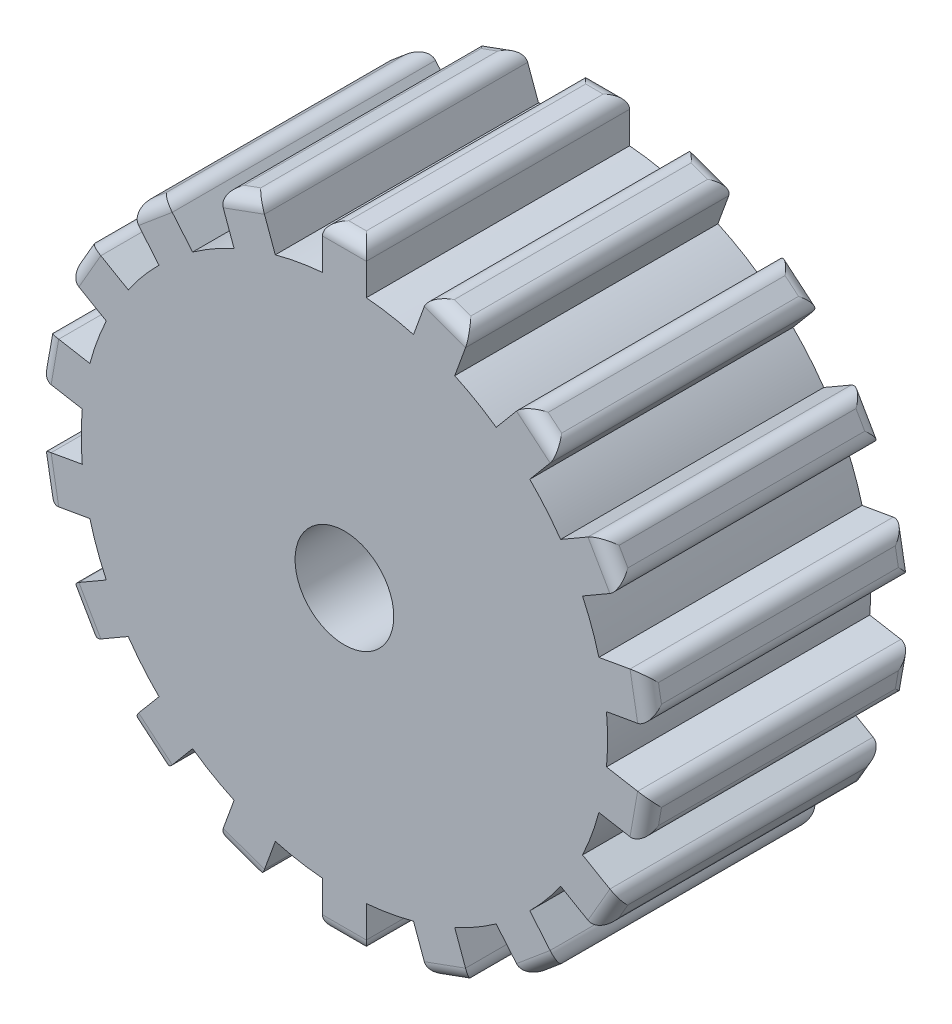
from build123d import *

# Parameters (mm, degrees)
SKETCH2_R                = 60
BOSS_EXTRUDE1_DEPTH      = 60
SKETCH3_W                = 10
SKETCH3_H                = 10.47851478
BOSS_EXTRUDE2_DEPTH      = 60
FILLET2_R                = 3
CIRPATTERN1_COUNT        = 18
FILLET2_OF_CIRPATTERN1_R = 3
SKETCH4_R                = 10
CUT_EXTRUDE1_DEPTH       = 60
SKETCH5_R                = 11.25
CUT_EXTRUDE2_DEPTH       = 60
SCALE1_SCALE             = 0.2


with BuildPart() as part:
    # Sketch2 → Boss-Extrude1 (new body)
    with BuildSketch(Plane.XY):
        Circle(SKETCH2_R)
    extrude(amount=BOSS_EXTRUDE1_DEPTH)

    # Sketch3 → Boss-Extrude2 (add)
    with BuildSketch(Plane.XY.offset(60)):
        with Locations((0, 64.76074261)):
            Rectangle(SKETCH3_W, SKETCH3_H)
    boss_extrude2 = extrude(amount=-BOSS_EXTRUDE2_DEPTH)

    # Fillet2
    fillet2_edges = [part.edges().sort_by_distance(p)[0] for p in [
        (5, 70, 30),
        (0, 70, 0),
        (-5, 70, 30),
        (0, 70, 60),
    ]]
    fillet(fillet2_edges, radius=FILLET2_R)

    # CirPattern1: Boss-Extrude2 ×18 about axis
    cirpattern1_axis = Axis((0, 0, 0), (0, 0, 1))
    for i in range(1, CIRPATTERN1_COUNT):
        add(boss_extrude2.rotate(cirpattern1_axis, i * 360 / CIRPATTERN1_COUNT))

    # Fillet2 of CirPattern1
    fillet2_of_cirpattern1_edges = [part.edges().sort_by_distance(p)[0] for p in [
        (-19.242946929, 67.488584172, 30),
        (-23.941410033, 65.778483455, 0),
        (-28.639873137, 64.068382738, 30),
        (-23.941410033, 65.778483455, 60),
        (-41.164910462, 56.837049067, 30),
        (-44.995132678, 53.623111018, 0),
        (-48.825354894, 50.40917297, 30),
        (-44.995132678, 53.623111018, 60),
        (-58.121778265, 39.330127019, 30),
        (-60.621778265, 35, 0),
        (-63.121778265, 30.669872981, 30),
        (-60.621778265, 35, 60),
        (-68.068301823, 17.079411202, 30),
        (-68.936542711, 12.155372437, 0),
        (-69.804783599, 7.231333672, 30),
        (-68.936542711, 12.155372437, 60),
        (-69.804783599, -7.231333672, 30),
        (-68.936542711, -12.155372437, 0),
        (-68.068301823, -17.079411202, 30),
        (-68.936542711, -12.155372437, 60),
        (-63.121778265, -30.669872981, 30),
        (-60.621778265, -35, 0),
        (-58.121778265, -39.330127019, 30),
        (-60.621778265, -35, 60),
        (-48.825354894, -50.40917297, 30),
        (-44.995132678, -53.623111018, 0),
        (-41.164910462, -56.837049067, 30),
        (-44.995132678, -53.623111018, 60),
        (-28.639873137, -64.068382738, 30),
        (-23.941410033, -65.778483455, 0),
        (-19.242946929, -67.488584172, 30),
        (-23.941410033, -65.778483455, 60),
        (-5, -70, 30),
        (0, -70, 0),
        (5, -70, 30),
        (0, -70, 60),
        (19.242946929, -67.488584172, 30),
        (23.941410033, -65.778483455, 0),
        (28.639873137, -64.068382738, 30),
        (23.941410033, -65.778483455, 60),
        (41.164910462, -56.837049067, 30),
        (44.995132678, -53.623111018, 0),
        (48.825354894, -50.40917297, 30),
        (44.995132678, -53.623111018, 60),
        (58.121778265, -39.330127019, 30),
        (60.621778265, -35, 0),
        (63.121778265, -30.669872981, 30),
        (60.621778265, -35, 60),
        (68.068301823, -17.079411202, 30),
        (68.936542711, -12.155372437, 0),
        (69.804783599, -7.231333672, 30),
        (68.936542711, -12.155372437, 60),
        (69.804783599, 7.231333672, 30),
        (68.936542711, 12.155372437, 0),
        (68.068301823, 17.079411202, 30),
        (68.936542711, 12.155372437, 60),
        (63.121778265, 30.669872981, 30),
        (60.621778265, 35, 0),
        (58.121778265, 39.330127019, 30),
        (60.621778265, 35, 60),
        (48.825354894, 50.40917297, 30),
        (44.995132678, 53.623111018, 0),
        (41.164910462, 56.837049067, 30),
        (44.995132678, 53.623111018, 60),
        (28.639873137, 64.068382738, 30),
        (23.941410033, 65.778483455, 0),
        (19.242946929, 67.488584172, 30),
        (23.941410033, 65.778483455, 60),
    ]]
    fillet(fillet2_of_cirpattern1_edges, radius=FILLET2_OF_CIRPATTERN1_R)

    # Sketch4 → Cut-Extrude1 (cut)
    with BuildSketch(Plane.XY.offset(60)):
        Circle(SKETCH4_R)
    extrude(amount=-CUT_EXTRUDE1_DEPTH, mode=Mode.SUBTRACT)

    # Sketch5 → Cut-Extrude2 (cut)
    with BuildSketch(Plane(origin=(0, 0, 0), x_dir=(-1, 0, 0), z_dir=(0, 0, -1))):
        Circle(SKETCH5_R)
    extrude(amount=-CUT_EXTRUDE2_DEPTH, mode=Mode.SUBTRACT)


with BuildPart() as part_1:
    # Scale1: scaled about (3e-09, 1e-09, 29.999999969)
    add(part.part.scale(SCALE1_SCALE).moved(Location((2e-09, 1e-09, 23.999999975))))


solid = part_1.part
